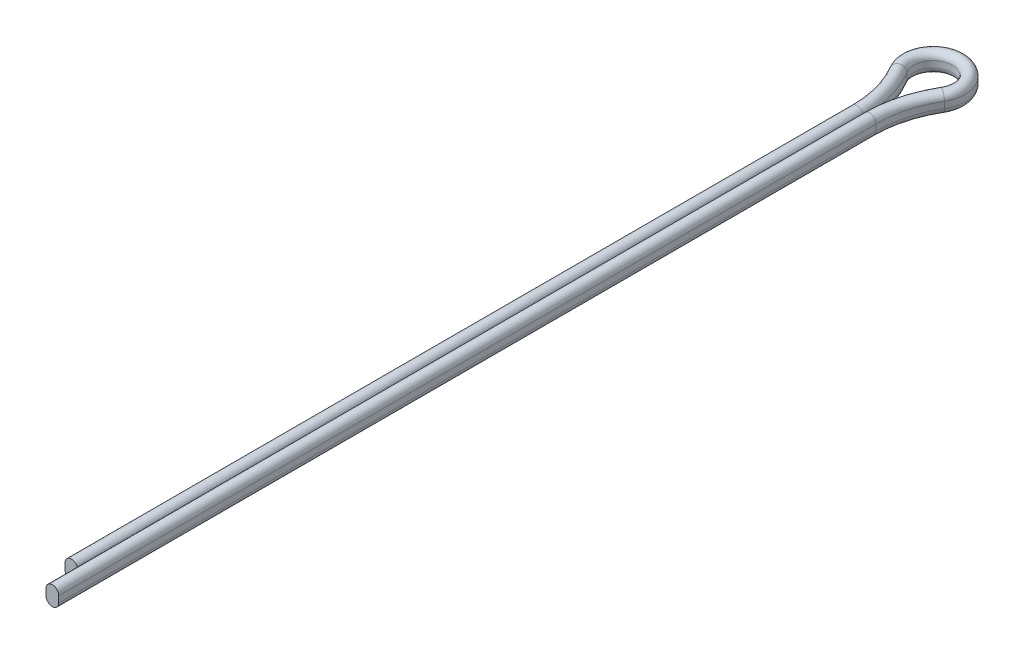
from build123d import *


with BuildPart() as part:
    # Sweep1: sweep along a path in Sketch1
    with BuildLine(Plane(origin=(0, 0, 0), x_dir=(1, 0, 0), z_dir=(0, 1, 0))) as sweep1_path:
        Line((-0.4, 2), (-0.4, 51.5))
        ThreePointArc((-0.4, 51.5), (-0.64900233, 53.359363001), (-1.378461538, 55.087692308))
        ThreePointArc((-1.378461538, 55.087692308), (0, 57.5), (1.378461538, 55.087692308))
        ThreePointArc((1.378461538, 55.087692308), (0.64900233, 53.359363001), (0.4, 51.5))
        Line((0.4, 51.5), (0.4, 0))
    # Sketch2 → Sweep1 (sweep)
    with BuildSketch(Plane.XY):
        with BuildLine():
            Line((0, -0.2), (0, 0.2))
            ThreePointArc((0, 0.2), (0.4, 0.6), (0.8, 0.2))
            Line((0.8, 0.2), (0.8, -0.2))
            ThreePointArc((0.8, -0.2), (0.4, -0.6), (0, -0.2))
        make_face()
    sweep(path=sweep1_path.line)


solid = part.part
